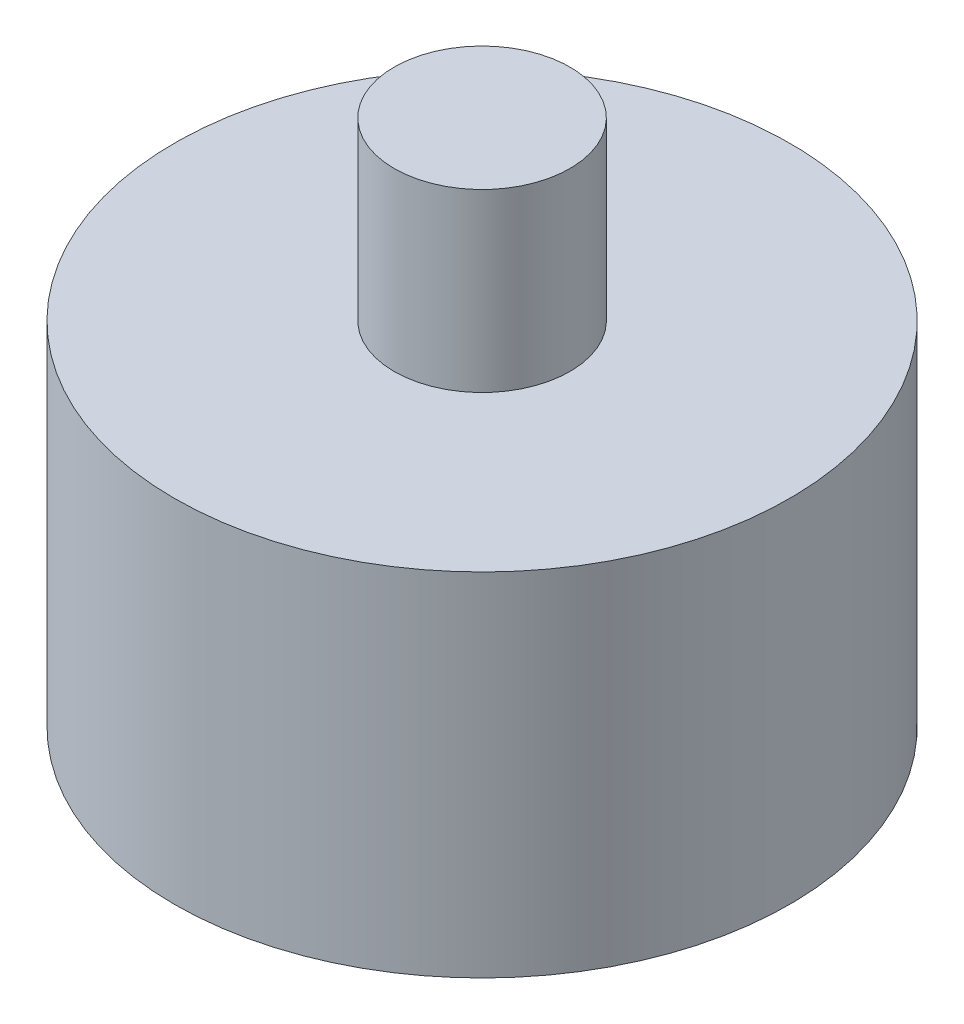
from build123d import *

# Parameters (mm, degrees)
SKETCH1_R           = 17.5
BOSS_EXTRUDE1_DEPTH = 20
SKETCH2_R           = 5
BOSS_EXTRUDE2_DEPTH = 10


with BuildPart() as part:
    # Sketch1 → Boss-Extrude1 (new body)
    with BuildSketch(Plane(origin=(0, 0, 0), x_dir=(1, 0, 0), z_dir=(0, 1, 0))):
        with Locations(Location((0, 0, 0), (0, 0, 270))):
            Circle(SKETCH1_R)
    extrude(amount=BOSS_EXTRUDE1_DEPTH)

    # Sketch2 → Boss-Extrude2 (add)
    with BuildSketch(Plane(origin=(0, 20, 0), x_dir=(1, 0, 0), z_dir=(0, 1, 0))):
        with Locations(Location((0, 0, 0), (0, 0, 270))):
            Circle(SKETCH2_R)
    extrude(amount=BOSS_EXTRUDE2_DEPTH)


solid = part.part
